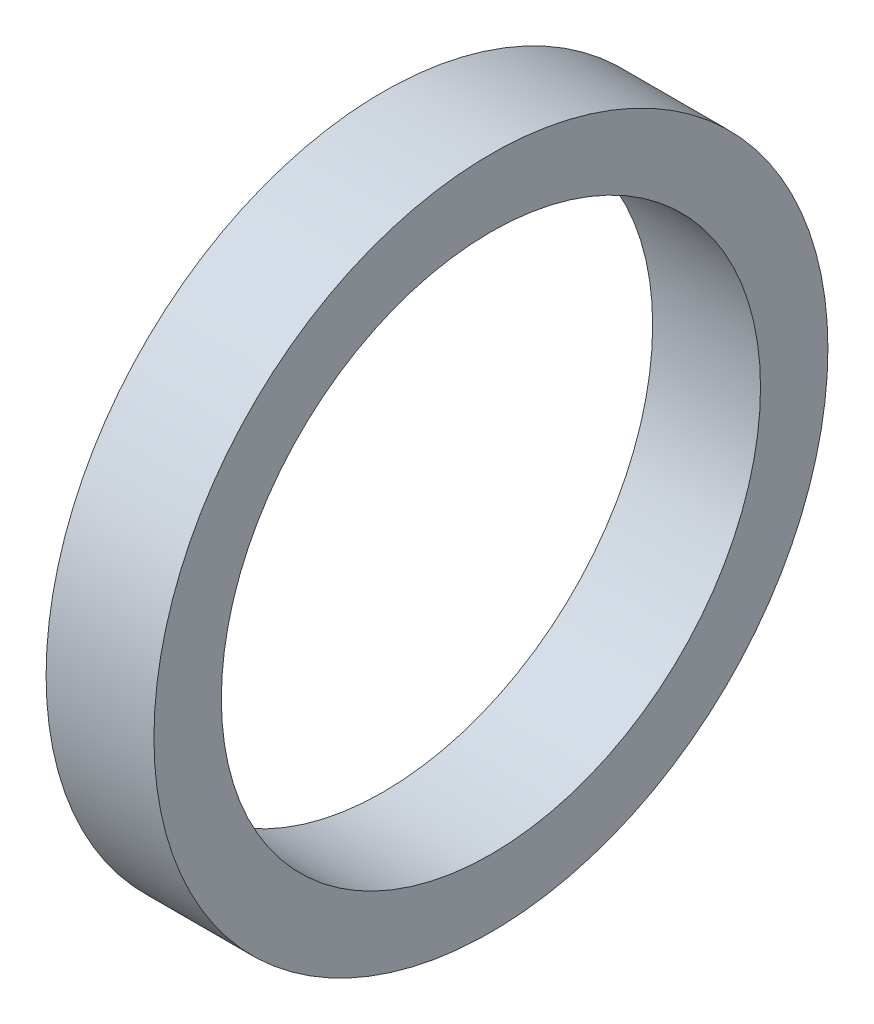
from build123d import *

# Parameters (mm, degrees)
SKETCH_1_R      = 25
SKETCH_1_R_2    = 20
EXTRUDE_1_DEPTH = 8


with BuildPart() as part:
    # 草图1 → 凸台-拉伸1 (new body)
    with BuildSketch(Plane(origin=(0, 0, 0), x_dir=(0, 0, -1), z_dir=(1, 0, 0))):
        Circle(SKETCH_1_R)
        Circle(SKETCH_1_R_2, mode=Mode.SUBTRACT)
    extrude(amount=EXTRUDE_1_DEPTH)


solid = part.part
